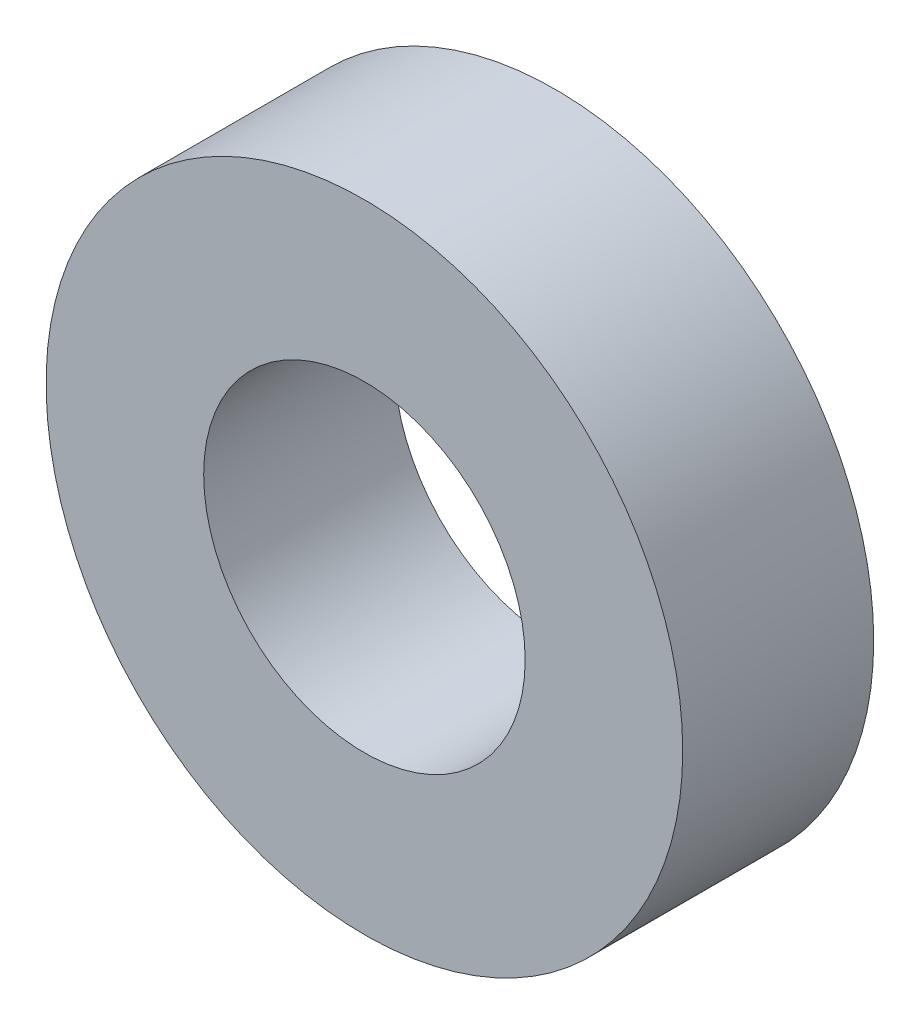
from build123d import *

# Parameters (mm, degrees)
ESQUISSE1_R        = 3
ESQUISSE1_R_2      = 1.515
BOSS_EXTRU_1_DEPTH = 1.8


with BuildPart() as part:
    # Esquisse1 → Boss.-Extru.1 (new body)
    with BuildSketch(Plane.XY):
        Circle(ESQUISSE1_R)
        Circle(ESQUISSE1_R_2, mode=Mode.SUBTRACT)
    extrude(amount=BOSS_EXTRU_1_DEPTH)


solid = part.part
